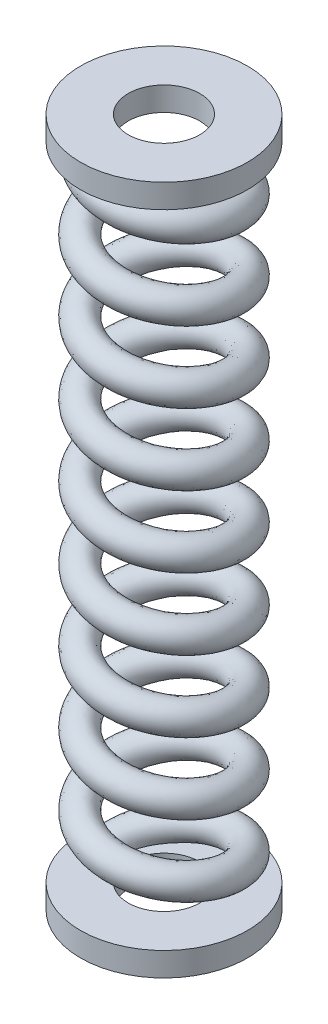
from build123d import *

# Parameters (mm, degrees)
BODY_PITCH       = 5.977777778
BODY_HEIGHT      = 53.8
BODY_RADIUS      = 5
BODY_START_ANGLE = -90
BODY_PROFILE_R   = 1.25
SKETCH17_R       = 7
BOTTOM_DEPTH     = 2
TOP_START        = 2
SKETCH24_R       = 7
TOP_DEPTH        = 2
SKETCH25_R       = 3
AXIS_HOLE_DEPTH  = 59.641623467


with BuildPart() as part:
    # Body: sweep along a helix
    with BuildLine() as body_path:
        add(Helix(BODY_PITCH, BODY_HEIGHT, BODY_RADIUS, center=(0, 0, 0), direction=(0, 1, 0), lefthand=True, mode=Mode.PRIVATE).rotate(Axis((0, 0, 0), (0, 1, 0)), BODY_START_ANGLE))
    # Body profile (on start of the path) → Body (sweep)
    with BuildSketch(Plane(origin=(-5, 0, 0), x_dir=(0, -0.9823742312762618, -0.18692477022688508), z_dir=(-1.416773812640865e-13, 0.18692477022688508, -0.9823742312762618))):
        Circle(BODY_PROFILE_R)
    sweep(path=body_path.line, is_frenet=True)

    # Sketch17 → Bottom (add)
    with BuildSketch(Plane(origin=(0, 0, 0), x_dir=(1, 0, 0), z_dir=(0, 1, 0))):
        with Locations(Location((0, 0, 0), (0, 0, 270))):
            Circle(SKETCH17_R)
    extrude(amount=-BOTTOM_DEPTH)

    # Sketch24 → Top (add)
    with BuildSketch(Plane(origin=(0, 53.8, 0), x_dir=(1, 0, 0), z_dir=(0, 1, 0)).offset(TOP_START)):
        with Locations(Location((0, 0, 0), (0, 0, 270))):
            Circle(SKETCH24_R)
    extrude(amount=-TOP_DEPTH)

    # Sketch25 → Axis_Hole (cut, through all)
    with BuildSketch(Plane.XZ.offset(2)):
        with Locations(Location((0, 0, 0), (0, 0, 270))):
            Circle(SKETCH25_R)
    extrude(amount=-AXIS_HOLE_DEPTH, mode=Mode.SUBTRACT)


solid = part.part
